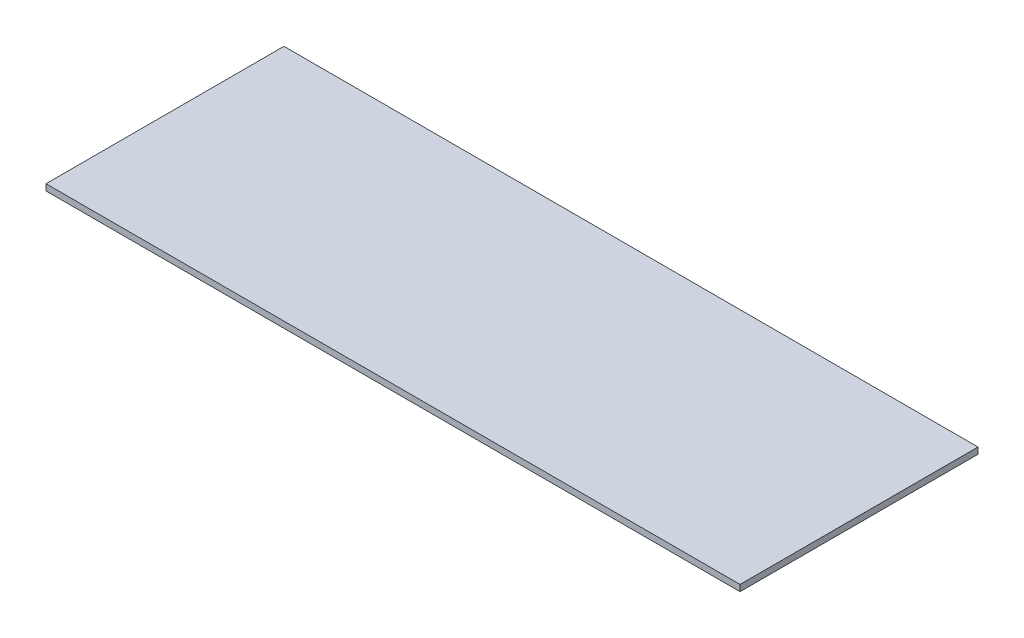
from build123d import *

# Parameters (mm, degrees)
SKETCH1_W           = 1400
SKETCH1_H           = 480
BOSS_EXTRUDE1_DEPTH = 12.7


with BuildPart() as part:
    # Sketch1 → Boss-Extrude1 (new body)
    with BuildSketch(Plane(origin=(0, 0, 0), x_dir=(1, 0, 0), z_dir=(0, 1, 0))):
        with Locations((700, 240)):
            Rectangle(SKETCH1_W, SKETCH1_H)
    extrude(amount=BOSS_EXTRUDE1_DEPTH)


solid = part.part
